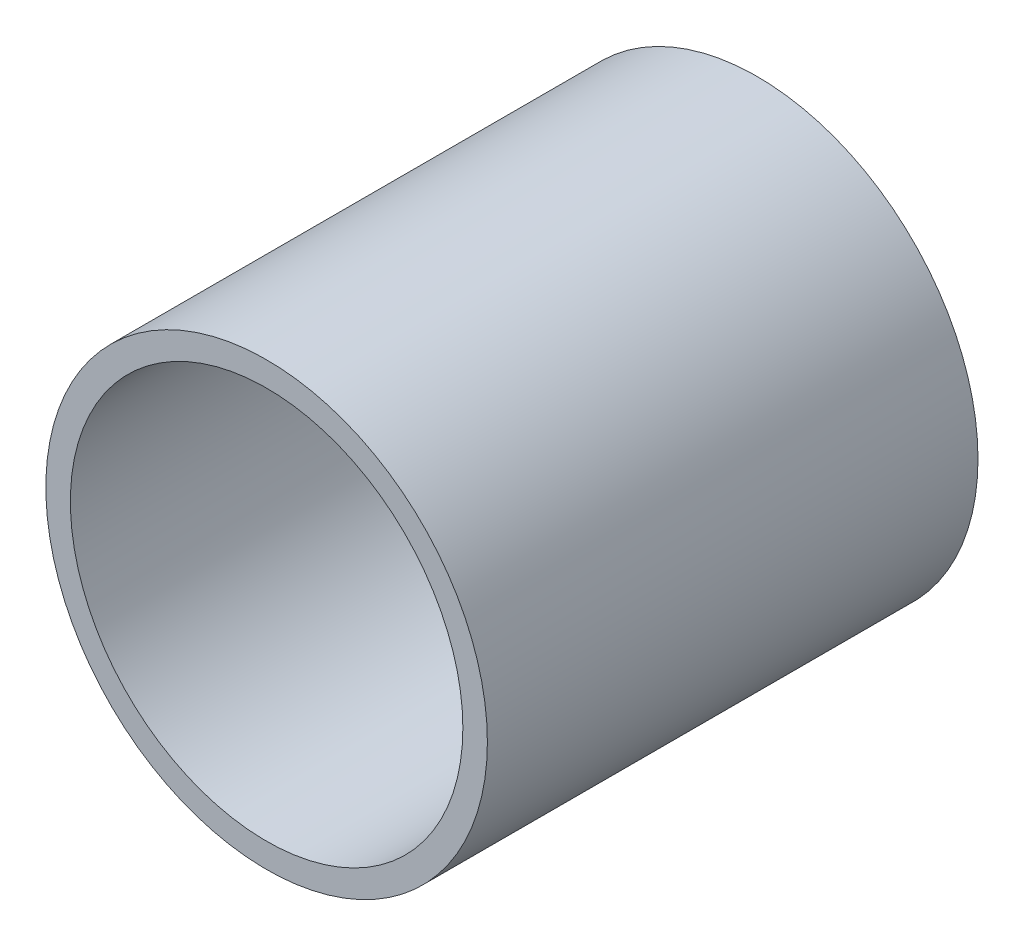
from build123d import *

# Parameters (mm, degrees)
SKETCH1_R           = 9
SKETCH1_R_2         = 8
BOSS_EXTRUDE1_DEPTH = 20


with BuildPart() as part:
    # Sketch1 → Boss-Extrude1 (new body)
    with BuildSketch(Plane.XY):
        Circle(SKETCH1_R)
        Circle(SKETCH1_R_2, mode=Mode.SUBTRACT)
    extrude(amount=BOSS_EXTRUDE1_DEPTH)


solid = part.part
